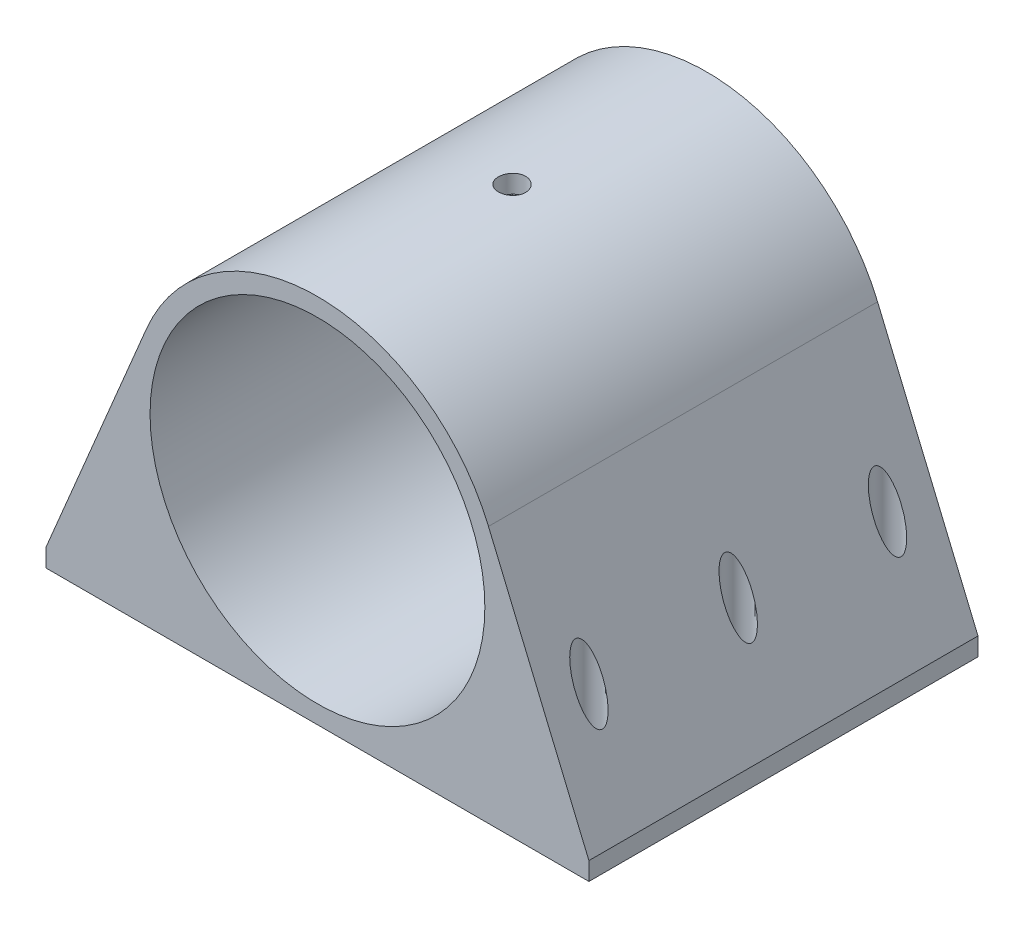
from build123d import *

# Parameters (mm, degrees)
SKETCH_1_R          = 18.5
SKETCH_1_R_2        = 2.1
SKETCH_1_R_3        = 6.35
EXTRUDE_1_DEPTH     = 43
SKETCH_2_R          = 18.5
CUT_EXTRUDE_1_DEPTH = 40
SKETCH_3_R          = 1.5
CUT_EXTRUDE_2_DEPTH = 40
SKETCH_4_R          = 1.5
CUT_EXTRUDE_3_DEPTH = 100


with BuildPart() as part:
    # Эскиз1 → Бобышка-Вытянуть1 (new body)
    # profile 1 of 2: a face of its own
    with BuildSketch(Plane.XY):
        with BuildLine():
            Line((30, -18.5), (18.901833927, 7.935406367))
            ThreePointArc((18.901833927, 7.935406367), (0, 20.5), (-18.901833927, 7.935406367))
            Line((-18.901833927, 7.935406367), (-30, -18.5))
            Line((-30, -18.5), (-30, -20.5))
            Line((-30, -20.5), (0, -20.5))
            Line((0, -20.5), (30, -20.5))
            Line((30, -20.5), (30, -18.5))
        make_face()
        Circle(SKETCH_1_R, mode=Mode.SUBTRACT)
    # profile 2 of 2: a face of its own
    with BuildSketch(Plane.XY):
        Circle(SKETCH_1_R)
        with Locations((7.75, 13.423393759)):
            Circle(SKETCH_1_R_2, mode=Mode.SUBTRACT)
        with Locations((-7.75, 13.423393759)):
            Circle(SKETCH_1_R_2, mode=Mode.SUBTRACT)
        with Locations((-15.5, 0)):
            Circle(SKETCH_1_R_2, mode=Mode.SUBTRACT)
        with Locations((-7.75, -13.423393759)):
            Circle(SKETCH_1_R_2, mode=Mode.SUBTRACT)
        with Locations((7.75, -13.423393759)):
            Circle(SKETCH_1_R_2, mode=Mode.SUBTRACT)
        with Locations((15.5, 0)):
            Circle(SKETCH_1_R_2, mode=Mode.SUBTRACT)
        with Locations((0, 7)):
            Circle(SKETCH_1_R_3, mode=Mode.SUBTRACT)
    extrude(amount=EXTRUDE_1_DEPTH)

    # Эскиз2 → Вырез-Вытянуть1 (cut)
    with BuildSketch(Plane.XY.offset(43)):
        Circle(SKETCH_2_R)
    extrude(amount=-CUT_EXTRUDE_1_DEPTH, mode=Mode.SUBTRACT)

    # Эскиз3 → Вырез-Вытянуть2 (cut)
    with BuildSketch(Plane(origin=(0, -20.5, 0), x_dir=(-1, 0, 0), z_dir=(0, -1, 0))):
        with Locations(Location((25, -38, 0), (0, 0, 90))):
            Circle(SKETCH_3_R)
        with Locations(Location((25, -21.5, 0), (0, 0, 90))):
            Circle(SKETCH_3_R)
        with Locations(Location((25, -5, 0), (0, 0, 90))):
            Circle(SKETCH_3_R)
        with Locations(Location((-25, -38, 0), (0, 0, 90))):
            Circle(SKETCH_3_R)
        with Locations(Location((-25, -21.5, 0), (0, 0, 90))):
            Circle(SKETCH_3_R)
        with Locations(Location((-25, -5, 0), (0, 0, 90))):
            Circle(SKETCH_3_R)
    extrude(amount=-CUT_EXTRUDE_2_DEPTH, mode=Mode.SUBTRACT)

    # Эскиз4 → Вырез-Вытянуть3 (cut)
    with BuildSketch(Plane(origin=(0, -20.5, 0), x_dir=(-1, 0, 0), z_dir=(0, -1, 0))):
        with Locations(Location((0, -21.5, 0), (0, 0, 90))):
            Circle(SKETCH_4_R)
    extrude(amount=-CUT_EXTRUDE_3_DEPTH, mode=Mode.SUBTRACT)


solid = part.part
